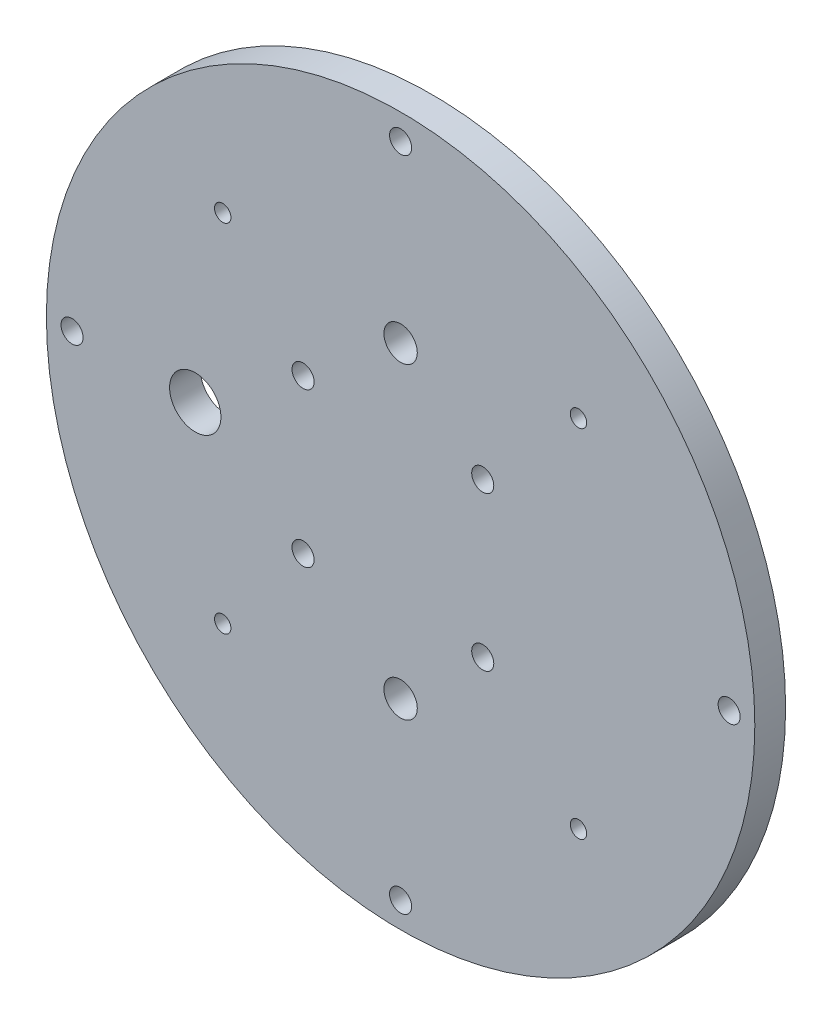
from build123d import *

# Parameters (mm, degrees)
SKETCH_1_R      = 69
SKETCH_1_R_2    = 1.6
SKETCH_1_R_3    = 2.15
SKETCH_1_R_4    = 3.25
SKETCH_1_R_5    = 5
EXTRUDE_1_DEPTH = 6


with BuildPart() as part:
    # 草圖1 → 填料-伸長1 (new body)
    with BuildSketch(Plane.XY):
        Circle(SKETCH_1_R)
        with Locations((34.648232278, 34.648232278)):
            Circle(SKETCH_1_R_2, mode=Mode.SUBTRACT)
        with Locations((-34.648232278, 34.648232278)):
            Circle(SKETCH_1_R_2, mode=Mode.SUBTRACT)
        with Locations((-34.648232278, -34.648232278)):
            Circle(SKETCH_1_R_2, mode=Mode.SUBTRACT)
        with Locations((34.648232278, -34.648232278)):
            Circle(SKETCH_1_R_2, mode=Mode.SUBTRACT)
        with Locations((64, 0)):
            Circle(SKETCH_1_R_3, mode=Mode.SUBTRACT)
        with Locations((0, 64)):
            Circle(SKETCH_1_R_3, mode=Mode.SUBTRACT)
        with Locations((-64, 0)):
            Circle(SKETCH_1_R_3, mode=Mode.SUBTRACT)
        with Locations((0, -64)):
            Circle(SKETCH_1_R_3, mode=Mode.SUBTRACT)
        with Locations((-19, 15)):
            Circle(SKETCH_1_R_3, mode=Mode.SUBTRACT)
        with Locations((-19, -15)):
            Circle(SKETCH_1_R_3, mode=Mode.SUBTRACT)
        with Locations((16, 15)):
            Circle(SKETCH_1_R_3, mode=Mode.SUBTRACT)
        with Locations((16, -15)):
            Circle(SKETCH_1_R_3, mode=Mode.SUBTRACT)
        with Locations((0, 30)):
            Circle(SKETCH_1_R_4, mode=Mode.SUBTRACT)
        with Locations((0, -30)):
            Circle(SKETCH_1_R_4, mode=Mode.SUBTRACT)
        with Locations((-40, 0)):
            Circle(SKETCH_1_R_5, mode=Mode.SUBTRACT)
    extrude(amount=EXTRUDE_1_DEPTH)


solid = part.part
